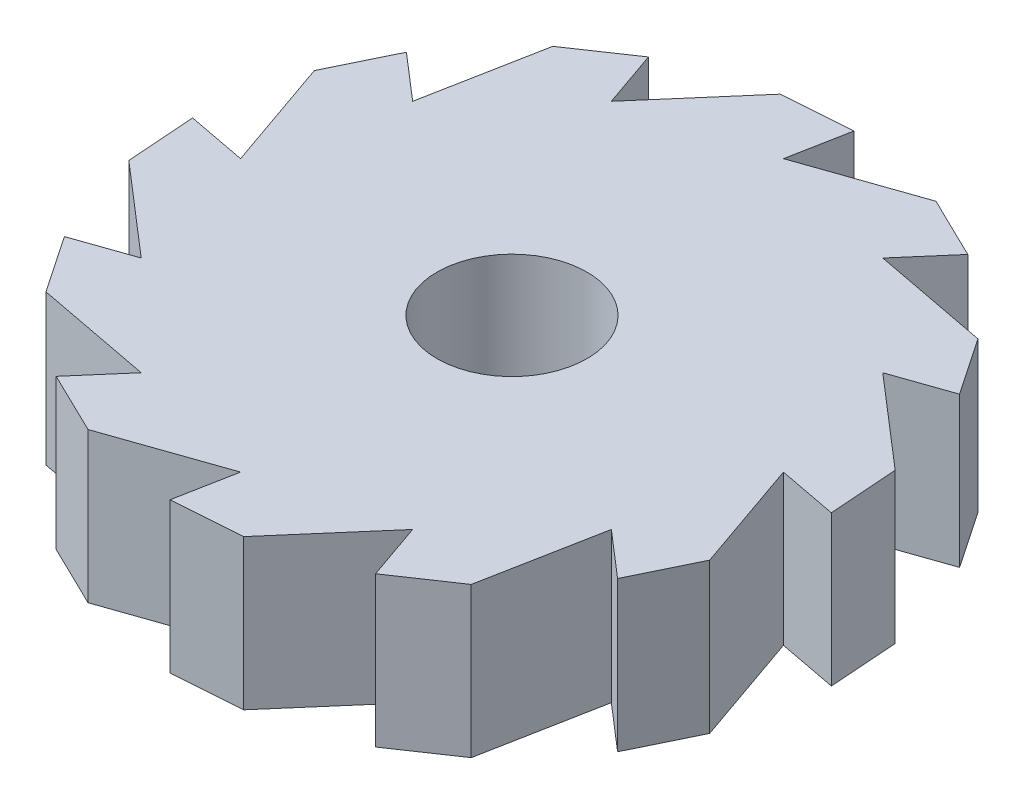
from build123d import *

# Parameters (mm, degrees)
SKETCH_1_R      = 5
EXTRUDE_1_DEPTH = 10


with BuildPart() as part:
    # 草图1 → 凸台-拉伸1 (new body)
    with BuildSketch(Plane(origin=(0, 0, 0), x_dir=(1, 0, 0), z_dir=(0, 1, 0))):
        Polygon((0, 18.091268752), (7.540032115, 20.716584923), (11.670850027, 18.708548438), (9.045634376, 15.667498326), (16.888151818, 14.171072765), (19.461526826, 10.366653202), (15.667498326, 9.045634376), (21.71110488, 3.828433104), (22.037503228, -0.752978388), (18.091268752, 0), (20.716584923, -7.540032115), (18.708548438, -11.670850027), (15.667498326, -9.045634376), (14.171072765, -16.888151818), (10.366653202, -19.461526826), (9.045634376, -15.667498326), (3.828433104, -21.71110488), (-0.752978388, -22.037503228), (0, -18.091268752), (-7.540032115, -20.716584923), (-11.670850027, -18.708548438), (-9.045634376, -15.667498326), (-16.888151818, -14.171072765), (-19.461526826, -10.366653202), (-15.667498326, -9.045634376), (-21.71110488, -3.828433104), (-22.037503228, 0.752978388), (-18.091268752, 0), (-20.716584923, 7.540032115), (-18.708548438, 11.670850027), (-15.667498326, 9.045634376), (-14.171072765, 16.888151818), (-10.366653202, 19.461526826), (-9.045634376, 15.667498326), (-3.828433104, 21.71110488), (0.752978388, 22.037503228), align=None)
        with Locations(Location((0, 0, 0), (0, 0, 270))):
            Circle(SKETCH_1_R, mode=Mode.SUBTRACT)
    extrude(amount=EXTRUDE_1_DEPTH)


solid = part.part
